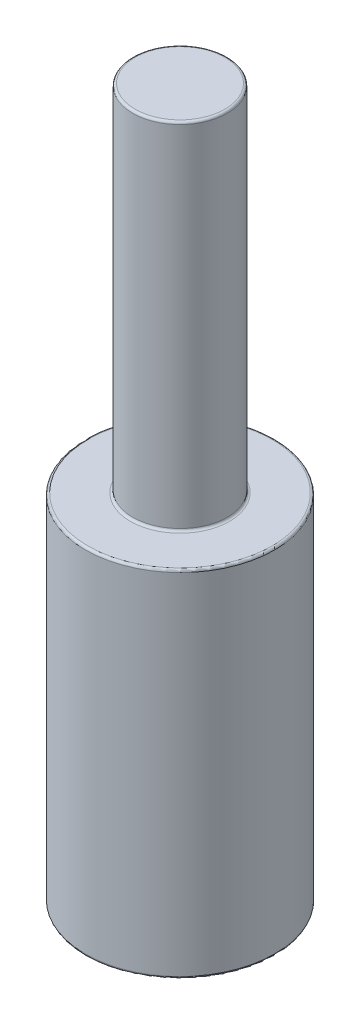
from build123d import *

# Parameters (mm, degrees)
SKETCH_1_R          = 40
EXTRUDE_1_DEPTH     = 300
SKETCH_2_OUTSIDE_W  = 146.124
SKETCH_2_OUTSIDE_H  = 146.124
SKETCH_2_OUTSIDE_R  = 20
CUT_EXTRUDE_1_DEPTH = 150
FILLET_2_R          = 1
FILLET_3_R          = 1
FILLET_4_R          = 1
FILLET_5_R          = 1


with BuildPart() as part:
    # Эскиз1 → Бобышка-Вытянуть1 (new body)
    with BuildSketch(Plane(origin=(0, 0, 0), x_dir=(1, 0, 0), z_dir=(0, 1, 0))):
        with Locations(Location((0, 0, 0), (0, 0, 270))):
            Circle(SKETCH_1_R)
    extrude(amount=EXTRUDE_1_DEPTH)

    # Эскиз2 outside → Вырез-Вытянуть1 (cut)
    with BuildSketch(Plane(origin=(0, 300, 0), x_dir=(1, 0, 0), z_dir=(0, 1, 0))):
        Rectangle(SKETCH_2_OUTSIDE_W, SKETCH_2_OUTSIDE_H)
        with Locations(Location((0, 0, 0), (0, 0, 270))):
            Circle(SKETCH_2_OUTSIDE_R, mode=Mode.SUBTRACT)
    extrude(amount=-CUT_EXTRUDE_1_DEPTH, mode=Mode.SUBTRACT)

    # Скругление2
    fillet_2_edges = [part.edges().sort_by_distance(p)[0] for p in [
        (0, 150, -20),
    ]]
    fillet(fillet_2_edges, radius=FILLET_2_R)

    # Скругление3
    fillet_3_edges = [part.edges().sort_by_distance(p)[0] for p in [
        (0, 300, -20),
    ]]
    fillet(fillet_3_edges, radius=FILLET_3_R)

    # Скругление4
    fillet_4_edges = [part.edges().sort_by_distance(p)[0] for p in [
        (0, 0, -40),
    ]]
    fillet(fillet_4_edges, radius=FILLET_4_R)

    # Скругление5
    fillet_5_edges = [part.edges().sort_by_distance(p)[0] for p in [
        (0, 150, -40),
    ]]
    fillet(fillet_5_edges, radius=FILLET_5_R)


solid = part.part
